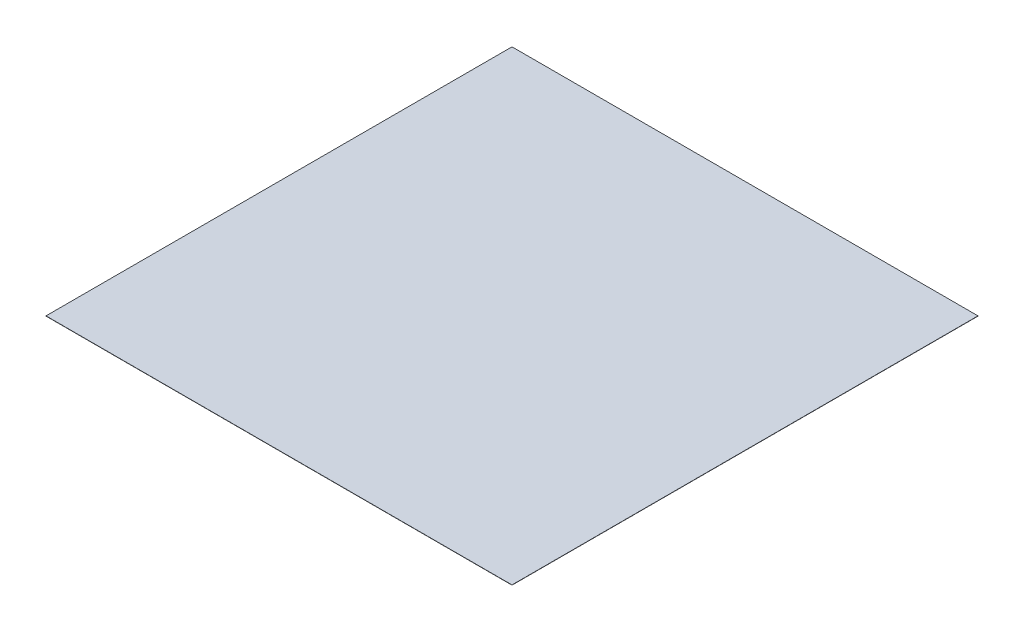
from build123d import *

# Parameters (mm, degrees)
SKETCH1_W           = 10000
SKETCH1_H           = 10000
BOSS_EXTRUDE1_DEPTH = 5


with BuildPart() as part:
    # Sketch1 → Boss-Extrude1 (new body)
    with BuildSketch(Plane(origin=(0, 0, 0), x_dir=(1, 0, 0), z_dir=(0, 1, 0))):
        Rectangle(SKETCH1_W, SKETCH1_H)
    extrude(amount=BOSS_EXTRUDE1_DEPTH)


solid = part.part
